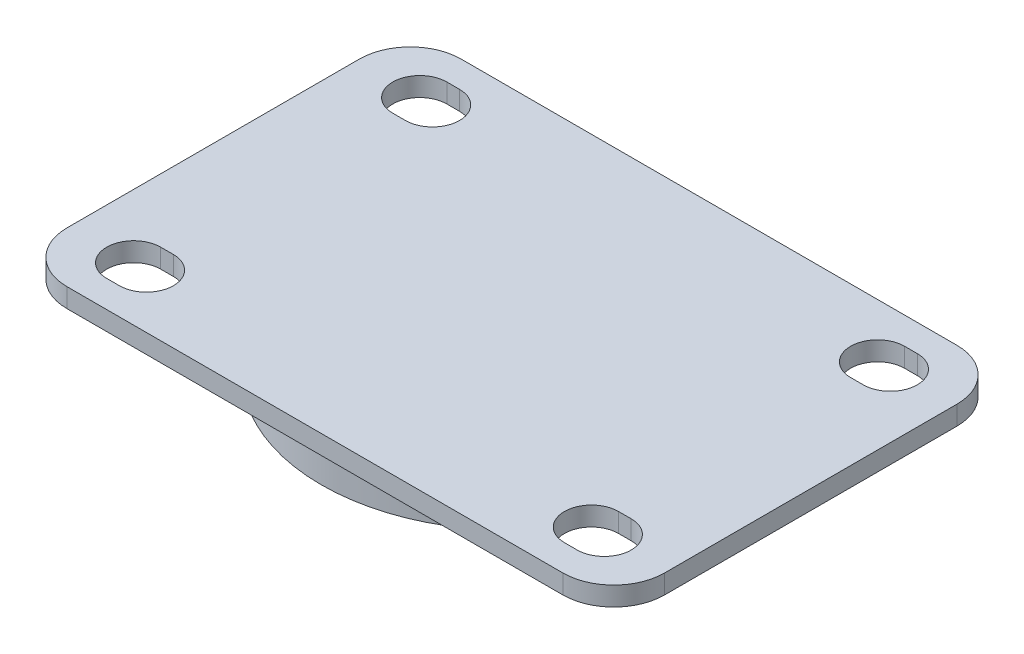
from build123d import *

# Parameters (mm, degrees)
SKETCH_1_W      = 94
SKETCH_1_H      = 62
EXTRUDE_1_DEPTH = 3
FILLET_1_R      = 8
SKETCH_7_R      = 30
EXTRUDE_2_DEPTH = 5


with BuildPart() as part:
    # 草图1 → 凸台-拉伸1 (new body)
    with BuildSketch(Plane(origin=(0, 0, 0), x_dir=(1, 0, 0), z_dir=(0, 1, 0))):
        Rectangle(SKETCH_1_W, SKETCH_1_H)
        with BuildLine():
            Line((-37, 26.75), (-35, 26.75))
            ThreePointArc((-35, 26.75), (-30.75, 22.5), (-35, 18.25))
            Line((-35, 18.25), (-37, 18.25))
            ThreePointArc((-37, 18.25), (-41.25, 22.5), (-37, 26.75))
        make_face(mode=Mode.SUBTRACT)
        with BuildLine():
            Line((37, 26.75), (35, 26.75))
            ThreePointArc((35, 26.75), (30.75, 22.5), (35, 18.25))
            Line((35, 18.25), (37, 18.25))
            ThreePointArc((37, 18.25), (41.25, 22.5), (37, 26.75))
        make_face(mode=Mode.SUBTRACT)
        with BuildLine():
            Line((37, -26.75), (35, -26.75))
            ThreePointArc((35, -26.75), (30.75, -22.5), (35, -18.25))
            Line((35, -18.25), (37, -18.25))
            ThreePointArc((37, -18.25), (41.25, -22.5), (37, -26.75))
        make_face(mode=Mode.SUBTRACT)
        with BuildLine():
            Line((-37, -26.75), (-35, -26.75))
            ThreePointArc((-35, -26.75), (-30.75, -22.5), (-35, -18.25))
            Line((-35, -18.25), (-37, -18.25))
            ThreePointArc((-37, -18.25), (-41.25, -22.5), (-37, -26.75))
        make_face(mode=Mode.SUBTRACT)
    extrude(amount=EXTRUDE_1_DEPTH)

    # 圆角1
    fillet_1_edges = [part.edges().sort_by_distance(p)[0] for p in [
        (-47, 1.5, -31),
        (47, 1.5, -31),
        (47, 1.5, 31),
        (-47, 1.5, 31),
    ]]
    fillet(fillet_1_edges, radius=FILLET_1_R)

    # 草图7 → 凸台-拉伸2 (add)
    with BuildSketch(Plane.XZ):
        with Locations(Location((0, 0, 0), (0, 0, 90))):
            Circle(SKETCH_7_R)
    extrude(amount=EXTRUDE_2_DEPTH)


solid = part.part
